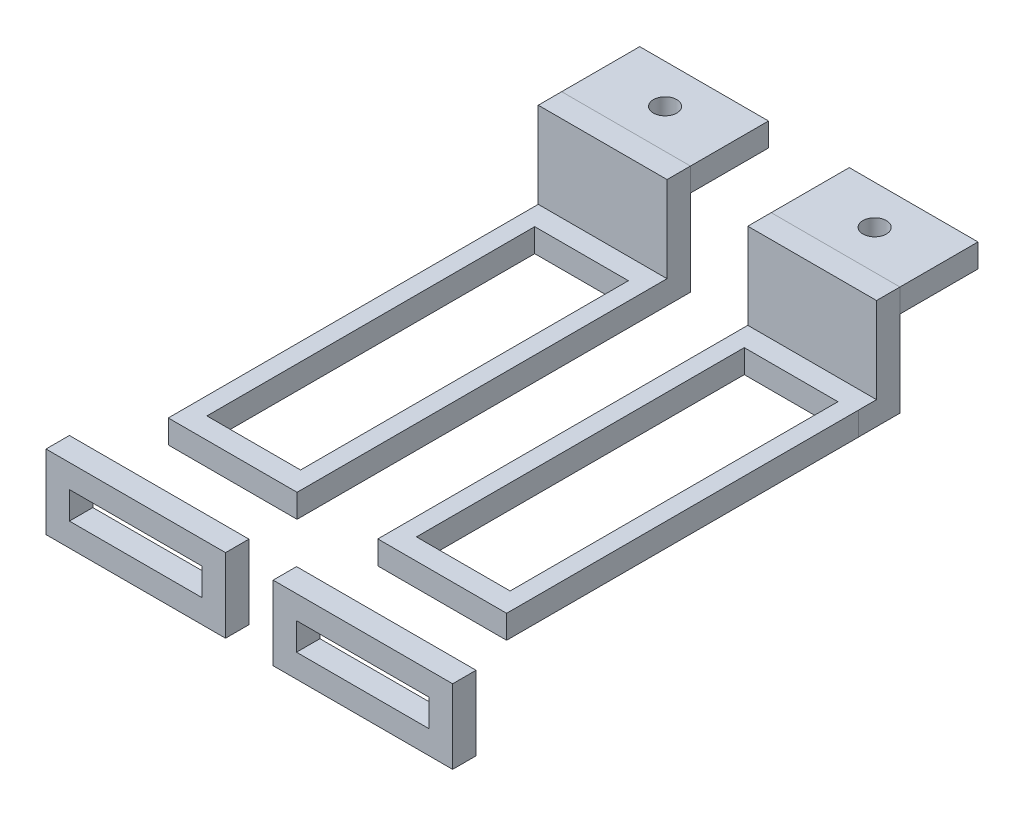
from build123d import *

# Parameters (mm, degrees)
SKETCH1_W               = 170
SKETCH1_H               = 3
BOSS_EXTRUDE1_DEPTH     = 10
SKETCH4_R               = 1.2
CUT_EXTRUDE1_DEPTH      = 21
SKETCH2_W               = 45.3
SKETCH2_H               = 3
BOSS_EXTRUDE6_DEPTH     = 20.3
SKETCH5_R               = 8.5
CUT_EXTRUDE2_DEPTH      = 20.3
SKETCH6_W               = 45.3
SKETCH6_H               = 3
BOSS_EXTRUDE7_DEPTH     = 20.3
SKETCH7_R               = 8.5
CUT_EXTRUDE3_DEPTH      = 100.885733504
SKETCH11_W              = 3
SKETCH11_H              = 14
BOSS_EXTRUDE10_DEPTH    = 16.5
SKETCH12_W              = 16.5
SKETCH12_H              = 3
BOSS_EXTRUDE11_DEPTH    = 47.4
SKETCH13_W              = 12
SKETCH13_H              = 42
CUT_EXTRUDE5_DEPTH      = 120.823102106
SKETCH14_W              = 23
SKETCH14_H              = 3
BOSS_EXTRUDE12_DEPTH    = 9.5
SKETCH15_W              = 17
SKETCH15_H              = 3.5
CUT_EXTRUDE6_DEPTH      = 9.5
CUT_EXTRUDE7_DEPTH      = 124.643656623
CUT_EXTRUDE7_DEPTH_BACK = 124.643656623
SKETCH16_W              = 63.359581381
SKETCH16_H              = 20.22579087
SKETCH16_W_2            = 63.3
SKETCH16_H_2            = 23.873064633
CUT_EXTRUDE9_DEPTH      = 85.468149706
CUT_EXTRUDE9_DEPTH_BACK = 85.468149706
SKETCH17_W              = 10.34603958
SKETCH17_H              = 19.965926612
SKETCH18_R              = 1.5
CUT_EXTRUDE10_DEPTH     = 10


with BuildPart() as part:
    # Sketch1 → Boss-Extrude1 (new body)
    with BuildSketch(Plane.XY):
        with Locations((13.639372454, -9.657761352)):
            Rectangle(SKETCH1_W, SKETCH1_H)
    extrude(amount=BOSS_EXTRUDE1_DEPTH)

    # Sketch4 → Cut-Extrude1 (cut)
    with BuildSketch(Plane(origin=(0, -8.157761352, 0), x_dir=(1, 0, 0), z_dir=(0, 1, 0))):
        with Locations(Location((-63.360627546, -4.938536908, 0), (0, 0, 180))):
            Circle(SKETCH4_R)
        with Locations(Location((90.639372454, -5.283238547, 0), (0, 0, 180))):
            Circle(SKETCH4_R)
    extrude(amount=-CUT_EXTRUDE1_DEPTH, mode=Mode.SUBTRACT)

    # Sketch2 → Boss-Extrude6 (add)
    with BuildSketch(Plane(origin=(0, -8.157761352, 0), x_dir=(1, 0, 0), z_dir=(0, 1, 0))):
        with Locations((-30.710627546, -8.5)):
            Rectangle(SKETCH2_W, SKETCH2_H)
    extrude(amount=BOSS_EXTRUDE6_DEPTH)

    # Sketch5 → Cut-Extrude2 (cut)
    with BuildSketch(Plane(origin=(0, 0, 7), x_dir=(-1, 0, 0), z_dir=(0, 0, -1))):
        with Locations((17.460627546, 1.942238648)):
            Circle(SKETCH5_R)
        with Locations((43.960627546, 1.942238648)):
            Circle(SKETCH5_R)
        with BuildLine():
            Line((27.510627546, -3.557761352), (33.910627546, -3.557761352))
            ThreePointArc((33.910627546, -3.557761352), (35.810627546, -5.457761352), (33.910627546, -7.357761352))
            Line((33.910627546, -7.357761352), (27.510627546, -7.357761352))
            ThreePointArc((27.510627546, -7.357761352), (25.610627546, -5.457761352), (27.510627546, -3.557761352))
        make_face()
    extrude(amount=-CUT_EXTRUDE2_DEPTH, mode=Mode.SUBTRACT)

    # Sketch6 → Boss-Extrude7 (add)
    with BuildSketch(Plane(origin=(0, -8.157761352, 0), x_dir=(1, 0, 0), z_dir=(0, 1, 0))):
        with Locations((57.989372454, -8.5)):
            Rectangle(SKETCH6_W, SKETCH6_H)
    extrude(amount=BOSS_EXTRUDE7_DEPTH)

    # Sketch7 → Cut-Extrude3 (cut, through all)
    with BuildSketch(Plane.XY.offset(10)):
        with Locations((44.739372454, 1.942238648)):
            Circle(SKETCH7_R)
        with Locations((71.239372454, 1.942238648)):
            Circle(SKETCH7_R)
        with BuildLine():
            Line((54.839372454, -3.557761352), (61.239372454, -3.557761352))
            ThreePointArc((61.239372454, -3.557761352), (63.139372454, -5.457761352), (61.239372454, -7.357761352))
            Line((61.239372454, -7.357761352), (54.839372454, -7.357761352))
            ThreePointArc((54.839372454, -7.357761352), (52.939372454, -5.457761352), (54.839372454, -3.557761352))
        make_face()
    extrude(amount=-CUT_EXTRUDE3_DEPTH, mode=Mode.SUBTRACT)


with BuildPart() as body_2:
    # Sketch11 → Boss-Extrude10 (new body)
    with BuildSketch(Plane(origin=(98.639372454, 0, 0), x_dir=(0, 0, -1), z_dir=(1, 0, 0))):
        with Locations((-11.5, -15.157761352)):
            Rectangle(SKETCH11_W, SKETCH11_H)
    extrude(amount=BOSS_EXTRUDE10_DEPTH)


with BuildPart() as body_2_1:
    # Body-Move/Copy1: moved
    add(body_2.part.moved(Location((-106.640418619, 0, 0))))

    # Sketch12 → Boss-Extrude11 (add)
    with BuildSketch(Plane.XY.offset(13)):
        with Locations((0.248953835, -20.657761352)):
            Rectangle(SKETCH12_W, SKETCH12_H)
    extrude(amount=BOSS_EXTRUDE11_DEPTH)

    # Sketch13 → Cut-Extrude5 (cut, through all)
    with BuildSketch(Plane(origin=(0, -19.157761352, 0), x_dir=(1, 0, 0), z_dir=(0, 1, 0))):
        with Locations((0.248953835, -36.7)):
            Rectangle(SKETCH13_W, SKETCH13_H)
    extrude(amount=-CUT_EXTRUDE5_DEPTH, mode=Mode.SUBTRACT)


with BuildPart() as body_3:
    # Body-Move/Copy3: copy of body 2
    add(body_2_1.part.moved(Location((26.84603958, 0, 0))))


with BuildPart() as body_4:
    # Sketch14 → Boss-Extrude12 (new body)
    with BuildSketch(Plane(origin=(0, -19.157761352, 0), x_dir=(1, 0, 0), z_dir=(0, 1, 0))):
        with Locations((-0.888899403, -70.178295355)):
            Rectangle(SKETCH14_W, SKETCH14_H)
    extrude(amount=-BOSS_EXTRUDE12_DEPTH)

    # Sketch15 → Cut-Extrude6 (cut)
    with BuildSketch(Plane.XY.offset(71.678295355)):
        with Locations((-0.888899403, -23.907761352)):
            Rectangle(SKETCH15_W, SKETCH15_H)
    extrude(amount=-CUT_EXTRUDE6_DEPTH, mode=Mode.SUBTRACT)


with BuildPart() as body_5:
    # Body-Move/Copy4: copy of body 4
    add(body_4.part.moved(Location((29.098347772, 0, 0))))


with BuildPart() as cut_extrude7_tool:
    # Sketch16 → Cut-Extrude7 (new, two sides: drawn at the far end of the back side and taken through both)
    with BuildSketch(Plane(origin=(0, -8.157761352, 0), x_dir=(1, 0, 0), z_dir=(0, 1, 0)).offset(-CUT_EXTRUDE7_DEPTH_BACK)):
        with Locations((-39.680836856, -5.049901743)):
            Rectangle(SKETCH16_W, SKETCH16_H)
        with Locations((66.989372454, -3.392050033)):
            Rectangle(SKETCH16_W_2, SKETCH16_H_2)
    extrude(amount=CUT_EXTRUDE7_DEPTH + CUT_EXTRUDE7_DEPTH_BACK)


with BuildPart() as part_1:
    add(part.part)

    # Cut-Extrude7: cut by cut_extrude7_tool
    add(cut_extrude7_tool.part, mode=Mode.SUBTRACT)

    # Sketch17 → Cut-Extrude9 (cut, two sides: drawn at the far end of the back side and taken through both)
    with BuildSketch(Plane(origin=(0, -8.157761352, 0), x_dir=(1, 0, 0), z_dir=(0, 1, 0)).offset(-CUT_EXTRUDE9_DEPTH_BACK)):
        with Locations((13.671973625, -0.017036694)):
            Rectangle(SKETCH17_W, SKETCH17_H)
    extrude(amount=CUT_EXTRUDE9_DEPTH + CUT_EXTRUDE9_DEPTH_BACK, mode=Mode.SUBTRACT)


with BuildPart() as body_3_1:
    add(body_3.part)

    # Cut-Extrude7: cut by cut_extrude7_tool
    add(cut_extrude7_tool.part, mode=Mode.SUBTRACT)


with BuildPart() as cut_extrude9_piece_1:
    # of the separate pieces the step leaves, piece 1, a body of its own (cut_extrude9_pieces)
    add(part_1.part.solids().sort_by_distance((8.498953835, -11.157761352, 0))[0])


with BuildPart() as cut_extrude9_piece_2:
    # of the separate pieces the step leaves, piece 2, a body of its own (cut_extrude9_pieces)
    add(part_1.part.solids().sort_by_distance((35.339372454, -11.157761352, 0))[0])


with BuildPart() as cut_extrude10_tool:
    # Sketch18 → Cut-Extrude10 (new body)
    with BuildSketch(Plane(origin=(0, -8.157761352, 0), x_dir=(1, 0, 0), z_dir=(0, 1, 0))):
        with Locations(Location((0.248953835, -5, 0), (0, 0, 180))):
            Circle(SKETCH18_R)
        with Locations(Location((27.094993415, -5, 0), (0, 0, 180))):
            Circle(SKETCH18_R)
    extrude(amount=-CUT_EXTRUDE10_DEPTH)


with BuildPart() as cut_extrude9_piece_1_1:
    add(cut_extrude9_piece_1.part)

    # Cut-Extrude10: cut by cut_extrude10_tool
    add(cut_extrude10_tool.part, mode=Mode.SUBTRACT)


with BuildPart() as cut_extrude9_piece_2_1:
    add(cut_extrude9_piece_2.part)

    # Cut-Extrude10: cut by cut_extrude10_tool
    add(cut_extrude10_tool.part, mode=Mode.SUBTRACT)


solid = Compound([body_2_1.part, body_4.part, body_5.part, body_3_1.part, cut_extrude9_piece_1_1.part, cut_extrude9_piece_2_1.part])
